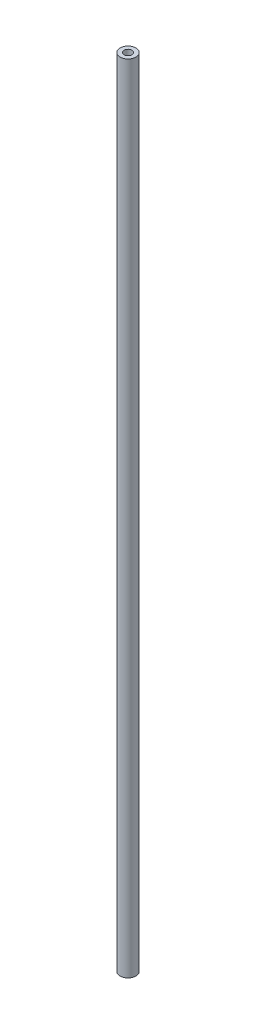
from build123d import *

# Parameters (mm, degrees)
CROQUIS1_W = 1
CROQUIS1_H = 200


with BuildPart() as part:
    # Croquis1 → Revolución1 (revolve)
    with BuildSketch(Plane.XY, mode=Mode.PRIVATE) as revoluci_n1_sk:
        with Locations((-1.5, 100)):
            Rectangle(CROQUIS1_W, CROQUIS1_H)
    revolve(revoluci_n1_sk.sketch.rotate(Axis((0, 0, 0), (0, 1, 0)), 270), axis=Axis((0, 0, 0), (0, 1, 0)))


solid = part.part
